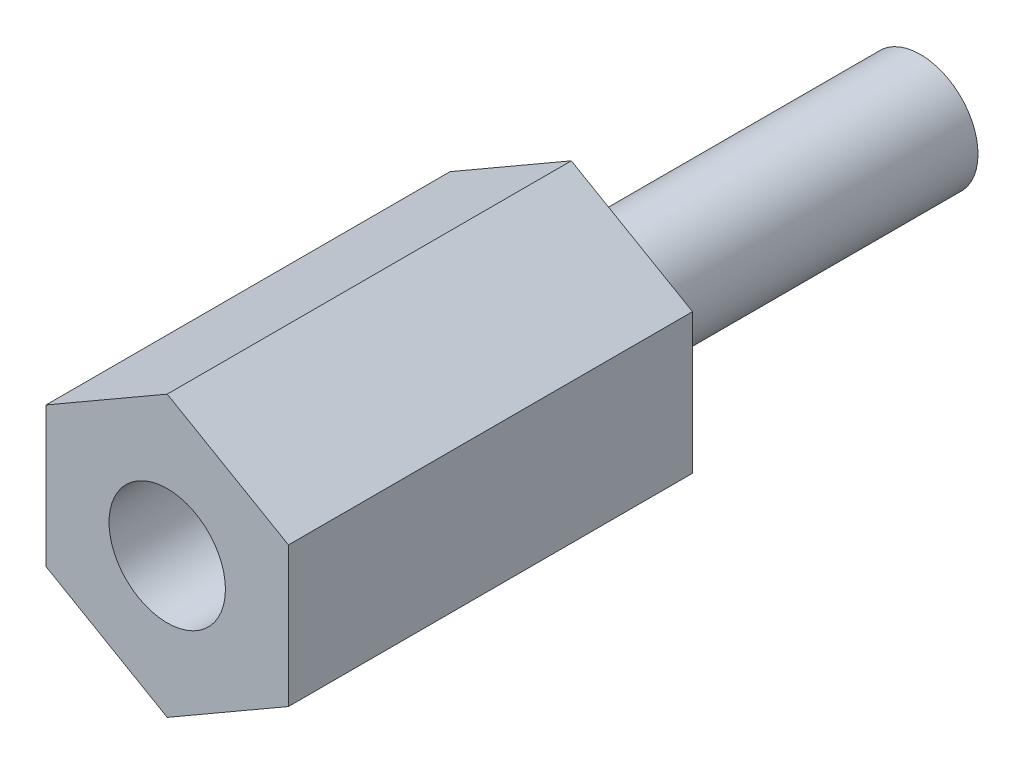
from build123d import *

# Parameters (mm, degrees)
BOSS_EXTRUDE1_DEPTH = 7.9375
SKETCH2_R           = 1.1303
BOSS_EXTRUDE2_DEPTH = 6.858
SKETCH3_R           = 1.143
CUT_EXTRUDE1_DEPTH  = 2.54


with BuildPart() as part:
    # Sketch1 → Boss-Extrude1 (new body)
    with BuildSketch(Plane.XY):
        Polygon((0, 2.749630657), (-2.38125, 1.374815329), (-2.38125, -1.374815329), (0, -2.749630657), (2.38125, -1.374815329), (2.38125, 1.374815329), align=None)
    extrude(amount=BOSS_EXTRUDE1_DEPTH)

    # Sketch2 → Boss-Extrude2 (add)
    with BuildSketch(Plane(origin=(0, 0, 0), x_dir=(-1, 0, 0), z_dir=(0, 0, -1))):
        with Locations(Location((0, 0, 0), (0, 0, 180))):
            Circle(SKETCH2_R)
    extrude(amount=BOSS_EXTRUDE2_DEPTH)

    # Sketch3 → Cut-Extrude1 (cut)
    with BuildSketch(Plane.XY.offset(7.9375)):
        Circle(SKETCH3_R)
    extrude(amount=-CUT_EXTRUDE1_DEPTH, mode=Mode.SUBTRACT)


solid = part.part
